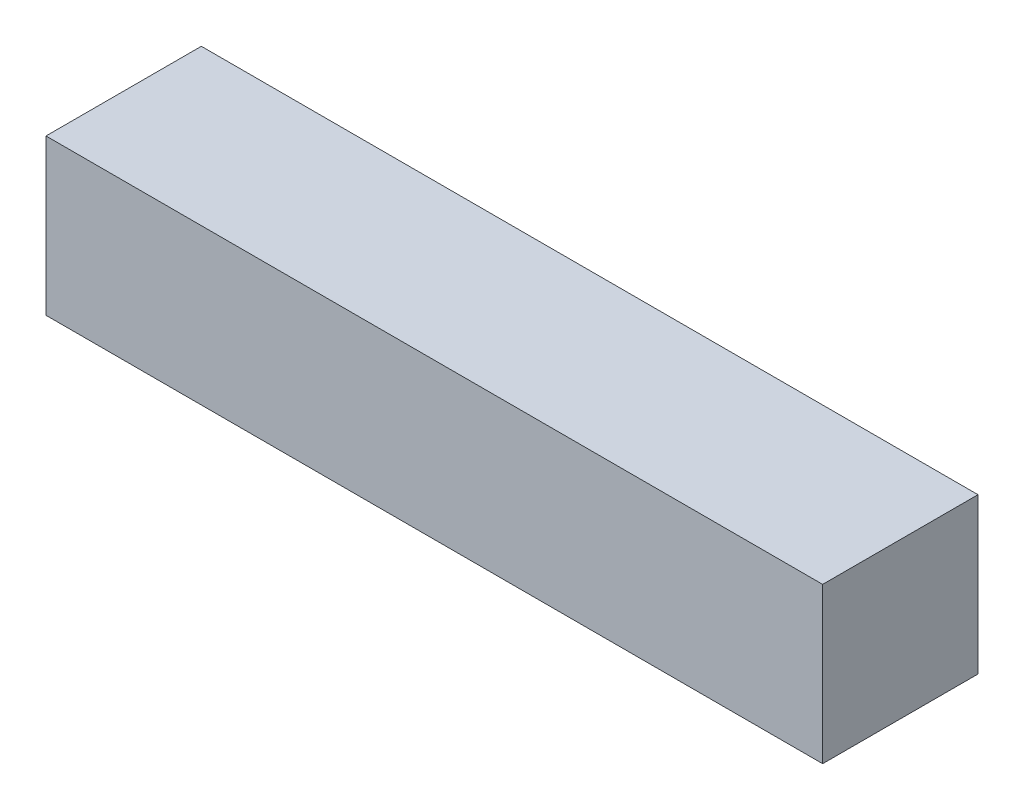
from build123d import *

# Parameters (mm, degrees)
SKETCH1_W           = 12.7
SKETCH1_H           = 12.7
BOSS_EXTRUDE1_DEPTH = 63.5


with BuildPart() as part:
    # Sketch1 → Boss-Extrude1 (new body)
    with BuildSketch(Plane(origin=(0, 0, 0), x_dir=(0, 0, -1), z_dir=(1, 0, 0))):
        with Locations((6.35, 6.35)):
            Rectangle(SKETCH1_W, SKETCH1_H)
    extrude(amount=BOSS_EXTRUDE1_DEPTH)


solid = part.part
